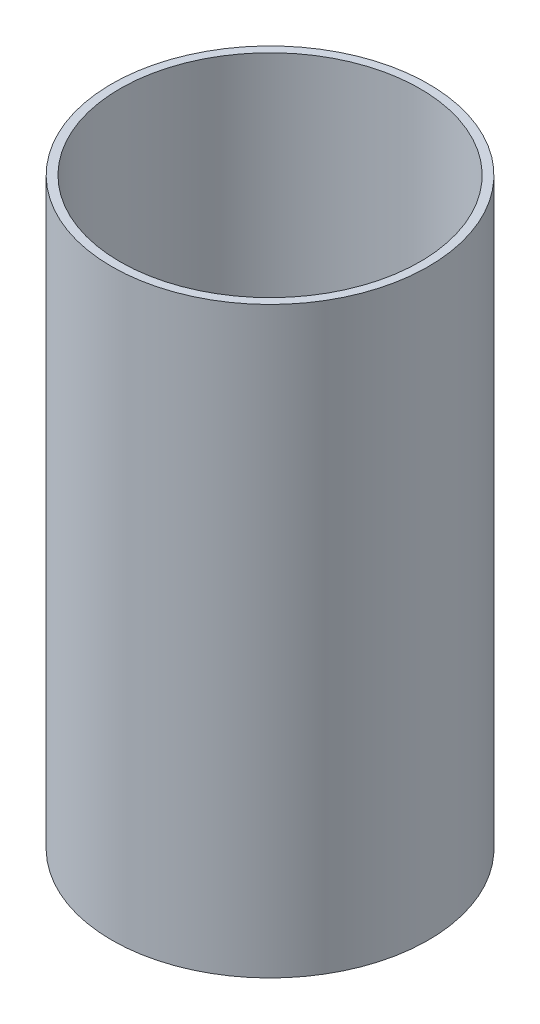
from build123d import *

# Parameters (mm, degrees)
SKETCH2_R           = 48.26
SKETCH2_R_2         = 45.72
BOSS_EXTRUDE1_DEPTH = 177.8


with BuildPart() as part:
    # Sketch2 → Boss-Extrude1 (new body)
    with BuildSketch(Plane(origin=(0, 0, 0), x_dir=(1, 0, 0), z_dir=(0, 1, 0))):
        with Locations(Location((0, 0, 0), (0, 0, 270))):
            Circle(SKETCH2_R)
        with Locations(Location((0, 0, 0), (0, 0, 270))):
            Circle(SKETCH2_R_2, mode=Mode.SUBTRACT)
    extrude(amount=BOSS_EXTRUDE1_DEPTH)


solid = part.part
